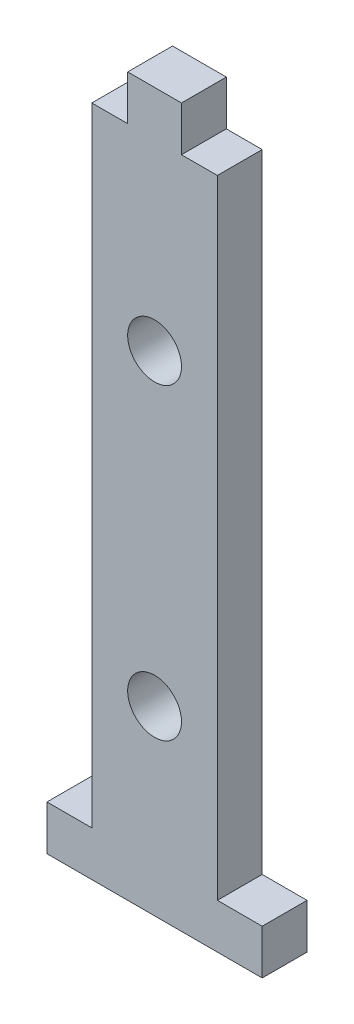
from build123d import *

# Parameters (mm, degrees)
SKETCH1_R           = 1.5
BOSS_EXTRUDE1_DEPTH = 2.5


with BuildPart() as part:
    # Sketch1 → Boss-Extrude1 (new body)
    with BuildSketch(Plane.XY):
        Polygon((1.5, 20), (-1.5, 20), (-1.5, 17.5), (-3.5, 17.5), (-3.5, -17.5), (-6, -17.5), (-6, -20), (6, -20), (6, -17.5), (3.5, -17.5), (3.5, 17.5), (1.5, 17.5), align=None)
        with Locations((0, -9.88)):
            Circle(SKETCH1_R, mode=Mode.SUBTRACT)
        with Locations((0, 7.28)):
            Circle(SKETCH1_R, mode=Mode.SUBTRACT)
    extrude(amount=BOSS_EXTRUDE1_DEPTH)


solid = part.part
